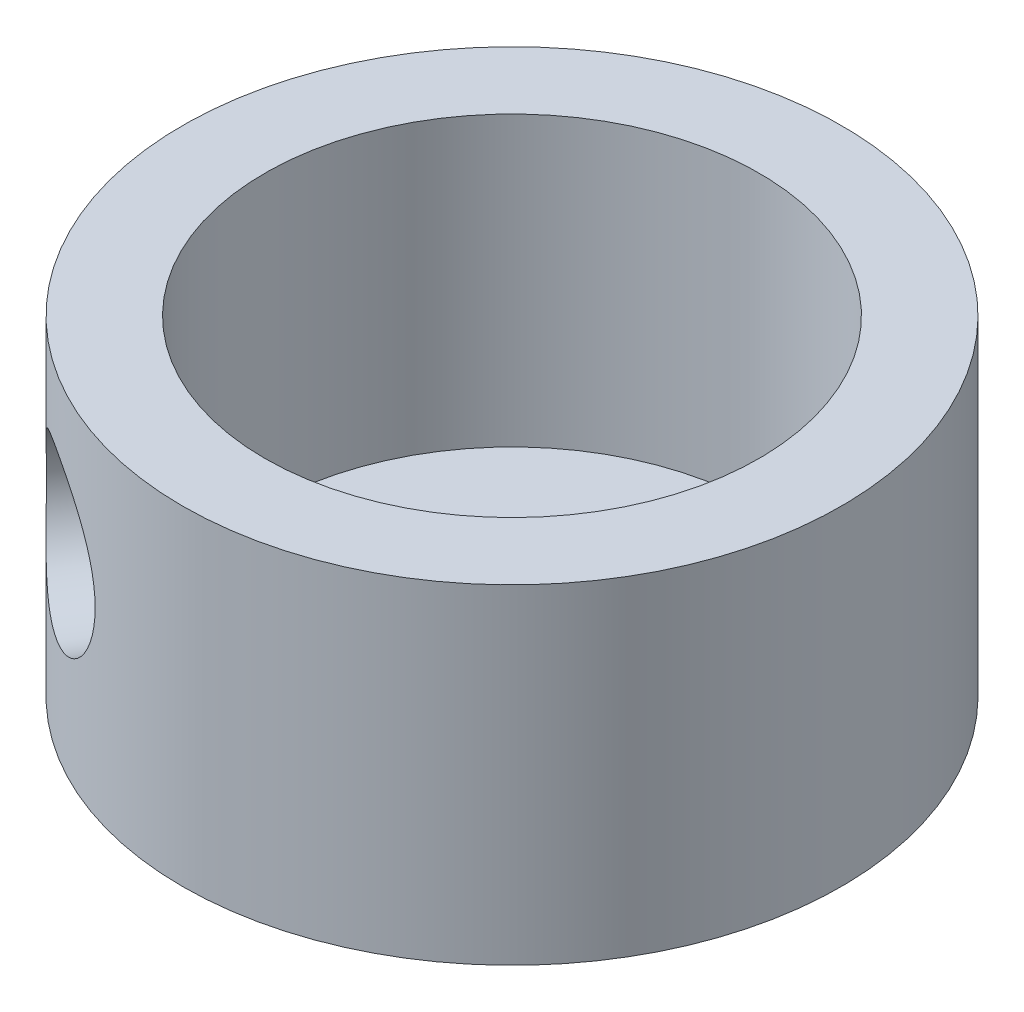
from build123d import *

# Parameters (mm, degrees)
SKETCH_1_R          = 40
EXTRUDE_1_DEPTH     = 40
SKETCH_3_R          = 30
CUT_EXTRUDE_2_DEPTH = 35
F_20_0MM_1_REACH    = 100.524
F_20_0MM_1_BORE_R   = 10


with BuildPart() as part:
    # 草圖1 → 填料-伸長1 (new body)
    with BuildSketch(Plane(origin=(0, 0, 0), x_dir=(1, 0, 0), z_dir=(0, 1, 0))):
        with Locations(Location((0, 0, 0), (0, 0, 270))):
            Circle(SKETCH_1_R)
    extrude(amount=EXTRUDE_1_DEPTH)

    # 草圖3 → 除料-伸長2 (cut)
    with BuildSketch(Plane(origin=(0, 40, 0), x_dir=(1, 0, 0), z_dir=(0, 1, 0))):
        with Locations(Location((0, 0, 0), (0, 0, 270))):
            Circle(SKETCH_3_R)
    extrude(amount=-CUT_EXTRUDE_2_DEPTH, mode=Mode.SUBTRACT)

    # Ø20.0mm 定位孔1 bore (on position points) → Ø20.0mm 定位孔1 (cut, up to next)
    with BuildSketch(Plane(origin=(-21.744758151, 21.94181737, 33.573285406), x_dir=(0.839332135156, 0, 0.543618953768), z_dir=(-0.543618953768, 0, 0.839332135156)), mode=Mode.PRIVATE) as f_20_0mm_1_sk1:
        Circle(F_20_0MM_1_BORE_R)
    f_20_0mm_1_tool1 = extrude(f_20_0mm_1_sk1.sketch, amount=-F_20_0MM_1_REACH, mode=Mode.PRIVATE) & part.part
    add(f_20_0mm_1_tool1.solids().sort_by_distance((-21.744758, 21.941817, 33.573285))[0], mode=Mode.SUBTRACT)


solid = part.part
